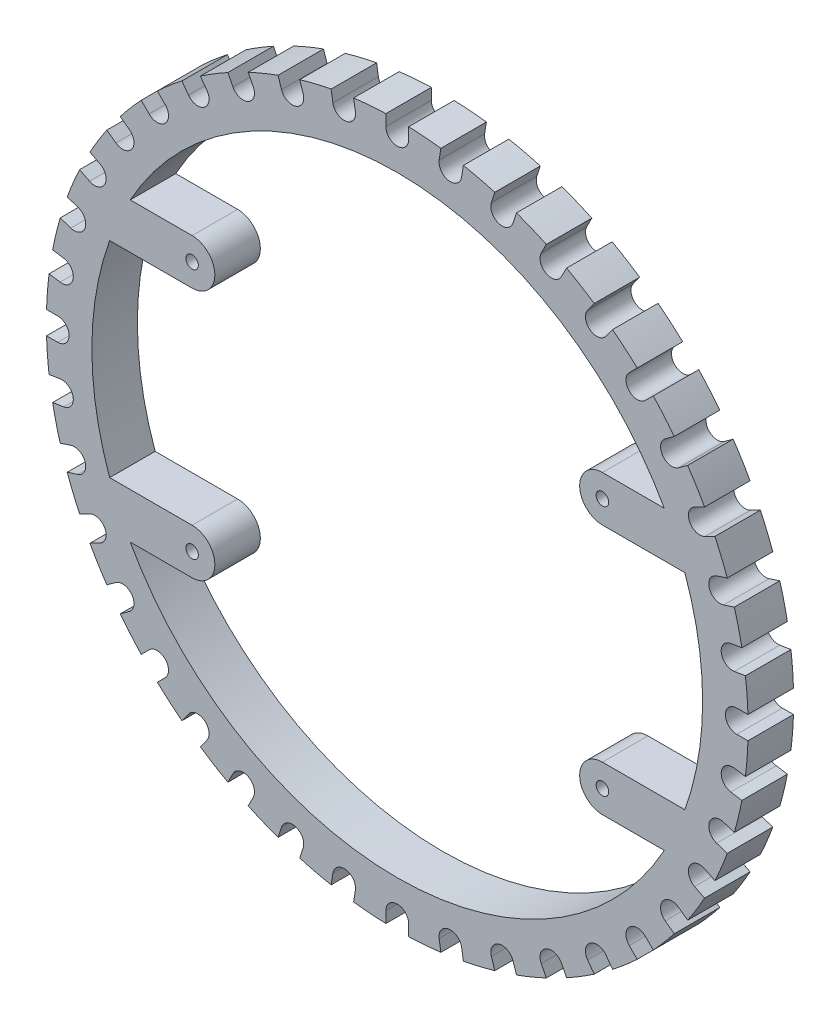
from build123d import *

# Parameters (mm, degrees)
SKETCH1_R           = 1.75
BOSS_EXTRUDE1_DEPTH = 12.7


with BuildPart() as part:
    # Sketch1 → Boss-Extrude1 (new body)
    with BuildSketch(Plane.XY):
        with BuildLine():
            Line((-3.175, -97.873515314), (-3.175, -94.75))
            ThreePointArc((-3.175, -94.75), (0, -91.575), (3.175, -94.75))
            Line((3.175, -94.75), (3.175, -97.873515314))
            ThreePointArc((3.175, -97.873515314), (7.683106949, -97.623129906), (12.174880528, -97.165209356))
            Line((12.174880528, -97.165209356), (11.686255081, -94.080149698))
            ThreePointArc((11.686255081, -94.080149698), (14.325486136, -90.44755979), (17.958076044, -93.086790845))
            Line((17.958076044, -93.086790845), (18.446701491, -96.171850503))
            ThreePointArc((18.446701491, -96.171850503), (22.860137256, -95.219324455), (27.224975092, -94.06437347))
            Line((27.224975092, -94.06437347), (26.259755778, -91.093733876))
            ThreePointArc((26.259755778, -91.093733876), (28.29823126, -87.09300048), (32.298964656, -89.131475962))
            Line((32.298964656, -89.131475962), (33.264183971, -92.102115555))
            ThreePointArc((33.264183971, -92.102115555), (37.474275114, -90.470903221), (41.604700415, -88.647360527))
            Line((41.604700415, -88.647360527), (40.186654136, -85.864288004))
            ThreePointArc((40.186654136, -85.864288004), (41.574180014, -81.593922453), (45.844545565, -82.98144833))
            Line((45.844545565, -82.98144833), (47.262591843, -85.764520854))
            ThreePointArc((47.262591843, -85.764520854), (51.16567195, -83.494788094), (54.959979935, -81.047555365))
            Line((54.959979935, -81.047555365), (53.124023698, -78.520578393))
            ThreePointArc((53.124023698, -78.520578393), (53.826434479, -74.08573126), (58.261281612, -74.788142041))
            Line((58.261281612, -74.788142041), (60.097237849, -77.315119013))
            ThreePointArc((60.097237849, -77.315119013), (63.597200133, -74.462754181), (66.961962347, -71.452090408))
            Line((66.961962347, -71.452090408), (64.753303487, -69.243431548))
            ThreePointArc((64.753303487, -69.243431548), (64.753303487, -64.753303487), (69.243431548, -64.753303487))
            Line((69.243431548, -64.753303487), (71.452090408, -66.961962347))
            ThreePointArc((71.452090408, -66.961962347), (74.462754181, -63.597200133), (77.315119013, -60.097237849))
            Line((77.315119013, -60.097237849), (74.788142041, -58.261281612))
            ThreePointArc((74.788142041, -58.261281612), (74.08573126, -53.826434479), (78.520578393, -53.124023698))
            Line((78.520578393, -53.124023698), (81.047555365, -54.959979935))
            ThreePointArc((81.047555365, -54.959979935), (83.494788094, -51.16567195), (85.764520854, -47.262591843))
            Line((85.764520854, -47.262591843), (82.98144833, -45.844545565))
            ThreePointArc((82.98144833, -45.844545565), (81.593922453, -41.574180014), (85.864288004, -40.186654136))
            Line((85.864288004, -40.186654136), (88.647360527, -41.604700415))
            ThreePointArc((88.647360527, -41.604700415), (90.470903221, -37.474275114), (92.102115555, -33.264183971))
            Line((92.102115555, -33.264183971), (89.131475962, -32.298964656))
            ThreePointArc((89.131475962, -32.298964656), (87.09300048, -28.29823126), (91.093733876, -26.259755778))
            Line((91.093733876, -26.259755778), (94.06437347, -27.224975092))
            ThreePointArc((94.06437347, -27.224975092), (95.219324455, -22.860137256), (96.171850503, -18.446701491))
            Line((96.171850503, -18.446701491), (93.086790845, -17.958076044))
            ThreePointArc((93.086790845, -17.958076044), (90.44755979, -14.325486136), (94.080149698, -11.686255081))
            Line((94.080149698, -11.686255081), (97.165209356, -12.174880528))
            ThreePointArc((97.165209356, -12.174880528), (97.623129906, -7.683106949), (97.873515314, -3.175))
            Line((97.873515314, -3.175), (94.75, -3.175))
            ThreePointArc((94.75, -3.175), (91.575, 0), (94.75, 3.175))
            Line((94.75, 3.175), (97.873515314, 3.175))
            ThreePointArc((97.873515314, 3.175), (97.623129906, 7.683106949), (97.165209356, 12.174880528))
            Line((97.165209356, 12.174880528), (94.080149698, 11.686255081))
            ThreePointArc((94.080149698, 11.686255081), (90.44755979, 14.325486136), (93.086790845, 17.958076044))
            Line((93.086790845, 17.958076044), (96.171850503, 18.446701491))
            ThreePointArc((96.171850503, 18.446701491), (95.219324455, 22.860137256), (94.06437347, 27.224975092))
            Line((94.06437347, 27.224975092), (91.093733876, 26.259755778))
            ThreePointArc((91.093733876, 26.259755778), (87.09300048, 28.29823126), (89.131475962, 32.298964656))
            Line((89.131475962, 32.298964656), (92.102115555, 33.264183971))
            ThreePointArc((92.102115555, 33.264183971), (90.470903221, 37.474275114), (88.647360527, 41.604700415))
            Line((88.647360527, 41.604700415), (85.864288004, 40.186654136))
            ThreePointArc((85.864288004, 40.186654136), (81.593922453, 41.574180014), (82.98144833, 45.844545565))
            Line((82.98144833, 45.844545565), (85.764520854, 47.262591843))
            ThreePointArc((85.764520854, 47.262591843), (83.494788094, 51.16567195), (81.047555365, 54.959979935))
            Line((81.047555365, 54.959979935), (78.520578393, 53.124023698))
            ThreePointArc((78.520578393, 53.124023698), (74.08573126, 53.826434479), (74.788142041, 58.261281612))
            Line((74.788142041, 58.261281612), (77.315119013, 60.097237849))
            ThreePointArc((77.315119013, 60.097237849), (74.462754181, 63.597200133), (71.452090408, 66.961962347))
            Line((71.452090408, 66.961962347), (69.243431548, 64.753303487))
            ThreePointArc((69.243431548, 64.753303487), (64.753303487, 64.753303487), (64.753303487, 69.243431548))
            Line((64.753303487, 69.243431548), (66.961962347, 71.452090408))
            ThreePointArc((66.961962347, 71.452090408), (63.597200133, 74.462754181), (60.097237849, 77.315119013))
            Line((60.097237849, 77.315119013), (58.261281612, 74.788142041))
            ThreePointArc((58.261281612, 74.788142041), (53.826434479, 74.08573126), (53.124023698, 78.520578393))
            Line((53.124023698, 78.520578393), (54.959979935, 81.047555365))
            ThreePointArc((54.959979935, 81.047555365), (51.16567195, 83.494788094), (47.262591843, 85.764520854))
            Line((47.262591843, 85.764520854), (45.844545565, 82.98144833))
            ThreePointArc((45.844545565, 82.98144833), (41.574180014, 81.593922453), (40.186654136, 85.864288004))
            Line((40.186654136, 85.864288004), (41.604700415, 88.647360527))
            ThreePointArc((41.604700415, 88.647360527), (37.474275114, 90.470903221), (33.264183971, 92.102115555))
            Line((33.264183971, 92.102115555), (32.298964656, 89.131475962))
            ThreePointArc((32.298964656, 89.131475962), (28.29823126, 87.09300048), (26.259755778, 91.093733876))
            Line((26.259755778, 91.093733876), (27.224975092, 94.06437347))
            ThreePointArc((27.224975092, 94.06437347), (22.860137256, 95.219324455), (18.446701491, 96.171850503))
            Line((18.446701491, 96.171850503), (17.958076044, 93.086790845))
            ThreePointArc((17.958076044, 93.086790845), (14.325486136, 90.44755979), (11.686255081, 94.080149698))
            Line((11.686255081, 94.080149698), (12.174880528, 97.165209356))
            ThreePointArc((12.174880528, 97.165209356), (7.683106949, 97.623129906), (3.175, 97.873515314))
            Line((3.175, 97.873515314), (3.175, 94.75))
            ThreePointArc((3.175, 94.75), (0, 91.575), (-3.175, 94.75))
            Line((-3.175, 94.75), (-3.175, 97.873515314))
            ThreePointArc((-3.175, 97.873515314), (-7.683106949, 97.623129906), (-12.174880528, 97.165209356))
            Line((-12.174880528, 97.165209356), (-11.686255081, 94.080149698))
            ThreePointArc((-11.686255081, 94.080149698), (-11.656953028, 93.8325779), (-11.647165563, 93.583470271))
            ThreePointArc((-11.647165563, 93.583470271), (-14.573057934, 90.418257737), (-17.958076044, 93.086790845))
            Line((-17.958076044, 93.086790845), (-18.446701491, 96.171850503))
            ThreePointArc((-18.446701491, 96.171850503), (-22.860137256, 95.219324455), (-27.224975092, 94.06437347))
            Line((-27.224975092, 94.06437347), (-26.259755778, 91.093733876))
            ThreePointArc((-26.259755778, 91.093733876), (-26.143449736, 90.609284345), (-26.104360217, 90.112604919))
            ThreePointArc((-26.104360217, 90.112604919), (-28.782680791, 86.976694438), (-32.298964656, 89.131475962))
            Line((-32.298964656, 89.131475962), (-33.264183971, 92.102115555))
            ThreePointArc((-33.264183971, 92.102115555), (-37.474275114, 90.470903221), (-41.604700415, 88.647360527))
            Line((-41.604700415, 88.647360527), (-40.186654136, 85.864288004))
            ThreePointArc((-40.186654136, 85.864288004), (-39.928325353, 85.164057197), (-39.84059985, 84.422868167))
            ThreePointArc((-39.84059985, 84.422868167), (-42.27441082, 81.33559367), (-45.844545565, 82.98144833))
            Line((-45.844545565, 82.98144833), (-47.262591843, 85.764520854))
            ThreePointArc((-47.262591843, 85.764520854), (-51.16567195, 83.494788094), (-54.959979935, 81.047555365))
            Line((-54.959979935, 81.047555365), (-53.124023698, 78.520578393))
            ThreePointArc((-53.124023698, 78.520578393), (-52.673048215, 77.635489174), (-52.517652655, 76.654360217))
            ThreePointArc((-52.517652655, 76.654360217), (-54.711523698, 73.634755778), (-58.261281612, 74.788142041))
            Line((-58.261281612, 74.788142041), (-60.097237849, 77.315119013))
            ThreePointArc((-60.097237849, 77.315119013), (-63.597200133, 74.462754181), (-66.961962347, 71.452090408))
            Line((-66.961962347, 71.452090408), (-64.753303487, 69.243431548))
            ThreePointArc((-64.753303487, 69.243431548), (-64.065050002, 68.213387415), (-63.823367517, 66.998367517))
            ThreePointArc((-63.823367517, 66.998367517), (-65.78334762, 64.065050002), (-69.243431548, 64.753303487))
            Line((-69.243431548, 64.753303487), (-71.452090408, 66.961962347))
            ThreePointArc((-71.452090408, 66.961962347), (-74.462754181, 63.597200133), (-77.315119013, 60.097237849))
            Line((-77.315119013, 60.097237849), (-74.788142041, 58.261281612))
            ThreePointArc((-74.788142041, 58.261281612), (-73.825414503, 57.134072491), (-73.479360217, 55.692652655))
            ThreePointArc((-73.479360217, 55.692652655), (-75.21294038, 52.86370694), (-78.520578393, 53.124023698))
            Line((-78.520578393, 53.124023698), (-81.047555365, 54.959979935))
            ThreePointArc((-81.047555365, 54.959979935), (-83.494788094, 51.16567195), (-85.764520854, 47.262591843))
            Line((-85.764520854, 47.262591843), (-82.98144833, 45.844545565))
            ThreePointArc((-82.98144833, 45.844545565), (-81.715735645, 44.674532793), (-81.247868167, 43.01559985))
            ThreePointArc((-81.247868167, 43.01559985), (-82.763935224, 40.308467328), (-85.864288004, 40.186654136))
            Line((-85.864288004, 40.186654136), (-88.647360527, 41.604700415))
            ThreePointArc((-88.647360527, 41.604700415), (-90.470903221, 37.474275114), (-92.102115555, 33.264183971))
            Line((-92.102115555, 33.264183971), (-89.131475962, 32.298964656))
            ThreePointArc((-89.131475962, 32.298964656), (-87.543975962, 31.145578393), (-86.937604919, 29.279360217))
            ThreePointArc((-86.937604919, 29.279360217), (-88.246386743, 26.71073126), (-91.093733876, 26.259755778))
            Line((-91.093733876, 26.259755778), (-94.06437347, 27.224975092))
            ThreePointArc((-94.06437347, 27.224975092), (-95.219324455, 22.860137256), (-96.171850503, 18.446701491))
            Line((-96.171850503, 18.446701491), (-93.086790845, 17.958076044))
            ThreePointArc((-93.086790845, 17.958076044), (-91.169181331, 16.884163116), (-90.408470271, 14.822165563))
            ThreePointArc((-90.408470271, 14.822165563), (-91.521472718, 12.407876622), (-94.080149698, 11.686255081))
            Line((-94.080149698, 11.686255081), (-97.165209356, 12.174880528))
            ThreePointArc((-97.165209356, 12.174880528), (-97.623129906, 7.683106949), (-97.873515314, 3.175))
            Line((-97.873515314, 3.175), (-94.75, 3.175))
            ThreePointArc((-94.75, 3.175), (-92.50493597, 2.24506403), (-91.575, 0))
            ThreePointArc((-91.575, 0), (-92.50493597, -2.24506403), (-94.75, -3.175))
            Line((-94.75, -3.175), (-97.873515314, -3.175))
            ThreePointArc((-97.873515314, -3.175), (-97.623129906, -7.683106949), (-97.165209356, -12.174880528))
            Line((-97.165209356, -12.174880528), (-94.080149698, -11.686255081))
            ThreePointArc((-94.080149698, -11.686255081), (-91.521472718, -12.407876622), (-90.408470271, -14.822165563))
            ThreePointArc((-90.408470271, -14.822165563), (-91.169181331, -16.884163116), (-93.086790845, -17.958076044))
            Line((-93.086790845, -17.958076044), (-96.171850503, -18.446701491))
            ThreePointArc((-96.171850503, -18.446701491), (-95.219324455, -22.860137256), (-94.06437347, -27.224975092))
            Line((-94.06437347, -27.224975092), (-91.093733876, -26.259755778))
            ThreePointArc((-91.093733876, -26.259755778), (-88.246386743, -26.71073126), (-86.937604919, -29.279360217))
            ThreePointArc((-86.937604919, -29.279360217), (-87.543975962, -31.145578393), (-89.131475962, -32.298964656))
            Line((-89.131475962, -32.298964656), (-92.102115555, -33.264183971))
            ThreePointArc((-92.102115555, -33.264183971), (-90.470903221, -37.474275114), (-88.647360527, -41.604700415))
            Line((-88.647360527, -41.604700415), (-85.864288004, -40.186654136))
            ThreePointArc((-85.864288004, -40.186654136), (-82.763935224, -40.308467328), (-81.247868167, -43.01559985))
            ThreePointArc((-81.247868167, -43.01559985), (-81.715735645, -44.674532793), (-82.98144833, -45.844545565))
            Line((-82.98144833, -45.844545565), (-85.764520854, -47.262591843))
            ThreePointArc((-85.764520854, -47.262591843), (-83.494788094, -51.16567195), (-81.047555365, -54.959979935))
            Line((-81.047555365, -54.959979935), (-78.520578393, -53.124023698))
            ThreePointArc((-78.520578393, -53.124023698), (-75.21294038, -52.86370694), (-73.479360217, -55.692652655))
            ThreePointArc((-73.479360217, -55.692652655), (-73.825414503, -57.134072491), (-74.788142041, -58.261281612))
            Line((-74.788142041, -58.261281612), (-77.315119013, -60.097237849))
            ThreePointArc((-77.315119013, -60.097237849), (-74.462754181, -63.597200133), (-71.452090408, -66.961962347))
            Line((-71.452090408, -66.961962347), (-69.243431548, -64.753303487))
            ThreePointArc((-69.243431548, -64.753303487), (-65.78334762, -64.065050002), (-63.823367517, -66.998367517))
            ThreePointArc((-63.823367517, -66.998367517), (-64.065050002, -68.213387415), (-64.753303487, -69.243431548))
            Line((-64.753303487, -69.243431548), (-66.961962347, -71.452090408))
            ThreePointArc((-66.961962347, -71.452090408), (-63.597200133, -74.462754181), (-60.097237849, -77.315119013))
            Line((-60.097237849, -77.315119013), (-58.261281612, -74.788142041))
            ThreePointArc((-58.261281612, -74.788142041), (-54.711523698, -73.634755778), (-52.517652655, -76.654360217))
            ThreePointArc((-52.517652655, -76.654360217), (-52.673048215, -77.635489174), (-53.124023698, -78.520578393))
            Line((-53.124023698, -78.520578393), (-54.959979935, -81.047555365))
            ThreePointArc((-54.959979935, -81.047555365), (-51.16567195, -83.494788094), (-47.262591843, -85.764520854))
            Line((-47.262591843, -85.764520854), (-45.844545565, -82.98144833))
            ThreePointArc((-45.844545565, -82.98144833), (-42.27441082, -81.33559367), (-39.84059985, -84.422868167))
            ThreePointArc((-39.84059985, -84.422868167), (-39.928325353, -85.164057197), (-40.186654136, -85.864288004))
            Line((-40.186654136, -85.864288004), (-41.604700415, -88.647360527))
            ThreePointArc((-41.604700415, -88.647360527), (-37.474275114, -90.470903221), (-33.264183971, -92.102115555))
            Line((-33.264183971, -92.102115555), (-32.298964656, -89.131475962))
            ThreePointArc((-32.298964656, -89.131475962), (-28.782680791, -86.976694438), (-26.104360217, -90.112604919))
            ThreePointArc((-26.104360217, -90.112604919), (-26.143449736, -90.609284345), (-26.259755778, -91.093733876))
            Line((-26.259755778, -91.093733876), (-27.224975092, -94.06437347))
            ThreePointArc((-27.224975092, -94.06437347), (-22.860137256, -95.219324455), (-18.446701491, -96.171850503))
            Line((-18.446701491, -96.171850503), (-17.958076044, -93.086790845))
            ThreePointArc((-17.958076044, -93.086790845), (-14.573057934, -90.418257737), (-11.647165563, -93.583470271))
            ThreePointArc((-11.647165563, -93.583470271), (-11.656953028, -93.8325779), (-11.686255081, -94.080149698))
            Line((-11.686255081, -94.080149698), (-12.174880528, -97.165209356))
            ThreePointArc((-12.174880528, -97.165209356), (-7.683106949, -97.623129906), (-3.175, -97.873515314))
        make_face()
        with Locations((-57.254, -35)):
            Circle(SKETCH1_R, mode=Mode.SUBTRACT)
        with BuildLine():
            ThreePointArc((-57.254, -41.35), (-50.904, -35), (-57.254, -28.65))
            Line((-57.254, -28.65), (-80.265049212, -28.65))
            ThreePointArc((-80.265049212, -28.65), (-85.225, 0), (-80.265049212, 28.65))
            Line((-80.265049212, 28.65), (-57.254, 28.65))
            ThreePointArc((-57.254, 28.65), (-50.904, 35), (-57.254, 41.35))
            Line((-57.254, 41.35), (-74.521662119, 41.35))
            ThreePointArc((-74.521662119, 41.35), (0, 85.225), (74.521662119, 41.35))
            Line((74.521662119, 41.35), (57.254, 41.35))
            ThreePointArc((57.254, 41.35), (50.904, 35), (57.254, 28.65))
            Line((57.254, 28.65), (80.265049212, 28.65))
            ThreePointArc((80.265049212, 28.65), (85.225, 0), (80.265049212, -28.65))
            Line((80.265049212, -28.65), (57.254, -28.65))
            ThreePointArc((57.254, -28.65), (50.904, -35), (57.254, -41.35))
            Line((57.254, -41.35), (74.521662119, -41.35))
            ThreePointArc((74.521662119, -41.35), (0, -85.225), (-74.521662119, -41.35))
            Line((-74.521662119, -41.35), (-57.254, -41.35))
        make_face(mode=Mode.SUBTRACT)
        with Locations((57.254, -35)):
            Circle(SKETCH1_R, mode=Mode.SUBTRACT)
        with Locations((-57.254, 35)):
            Circle(SKETCH1_R, mode=Mode.SUBTRACT)
        with Locations((57.254, 35)):
            Circle(SKETCH1_R, mode=Mode.SUBTRACT)
    extrude(amount=BOSS_EXTRUDE1_DEPTH)


solid = part.part
